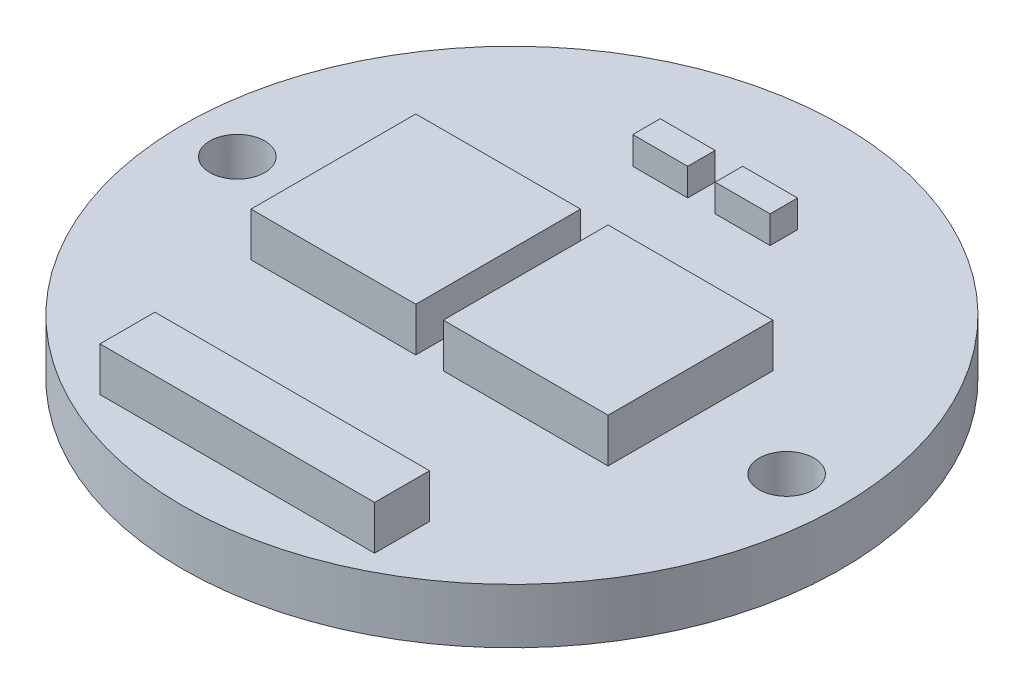
from build123d import *

# Parameters (mm, degrees)
SKETCH_1_R          = 6
EXTRUDE_1_DEPTH     = 1
SKETCH_2_W          = 3
SKETCH_2_H          = 3
SKETCH_2_W_2        = 5
SKETCH_2_H_2        = 1
EXTRUDE_2_DEPTH     = 0.8
SKETCH_2_6_W        = 1
SKETCH_2_6_H        = 0.5
EXTRUDE_3_DEPTH     = 0.5
SKETCH_4_W          = 5
SKETCH_4_H          = 5
EXTRUDE_4_DEPTH     = 1
CUT_EXTRUDE_1_REACH = 10.718
SKETCH_5_R          = 0.5


with BuildPart() as part:
    # 草图1 → 凸台-拉伸1 (new body)
    with BuildSketch(Plane(origin=(0, 0, 0), x_dir=(1, 0, 0), z_dir=(0, 1, 0))):
        Circle(SKETCH_1_R)
    extrude(amount=EXTRUDE_1_DEPTH)

    # 草图2 → 凸台-拉伸2 (add)
    with BuildSketch(Plane(origin=(0, 1, 0), x_dir=(1, 0, 0), z_dir=(0, 1, 0))):
        with Locations((1.75, 0)):
            Rectangle(SKETCH_2_W, SKETCH_2_H)
        with Locations((-1.75, 0)):
            Rectangle(SKETCH_2_W, SKETCH_2_H)
        with Locations((0, -4.5)):
            Rectangle(SKETCH_2_W_2, SKETCH_2_H_2)
    extrude(amount=EXTRUDE_2_DEPTH)

    # 草图2<6> → 凸台-拉伸3 (add)
    with BuildSketch(Plane(origin=(0, 1, 0), x_dir=(1, 0, 0), z_dir=(0, 1, 0))):
        with Locations((0.75, 3.7)):
            Rectangle(SKETCH_2_6_W, SKETCH_2_6_H)
        with Locations((-0.75, 3.7)):
            Rectangle(SKETCH_2_6_W, SKETCH_2_6_H)
    extrude(amount=EXTRUDE_3_DEPTH)

    # 草图4 → 凸台-拉伸4 (add)
    with BuildSketch(Plane.XZ):
        Rectangle(SKETCH_4_W, SKETCH_4_H)
    extrude(amount=EXTRUDE_4_DEPTH)

    # 草图5 → 切除-拉伸1 (cut, up to next)
    with BuildSketch(Plane(origin=(0, 1, 0), x_dir=(1, 0, 0), z_dir=(0, 1, 0)), mode=Mode.PRIVATE) as cut_extrude_1_sk1:
        with Locations((5, 0)):
            Circle(SKETCH_5_R)
    cut_extrude_1_tool1 = extrude(cut_extrude_1_sk1.sketch, amount=-CUT_EXTRUDE_1_REACH, mode=Mode.PRIVATE) & part.part
    # 草图5 → 切除-拉伸1 (cut, up to next)
    with BuildSketch(Plane(origin=(0, 1, 0), x_dir=(1, 0, 0), z_dir=(0, 1, 0)), mode=Mode.PRIVATE) as cut_extrude_1_sk2:
        with Locations((-5, 0)):
            Circle(SKETCH_5_R)
    cut_extrude_1_tool2 = extrude(cut_extrude_1_sk2.sketch, amount=-CUT_EXTRUDE_1_REACH, mode=Mode.PRIVATE) & part.part
    add(cut_extrude_1_tool1.solids().sort_by_distance((5, 1, 0))[0], mode=Mode.SUBTRACT)
    add(cut_extrude_1_tool2.solids().sort_by_distance((-5, 1, 0))[0], mode=Mode.SUBTRACT)


solid = part.part
